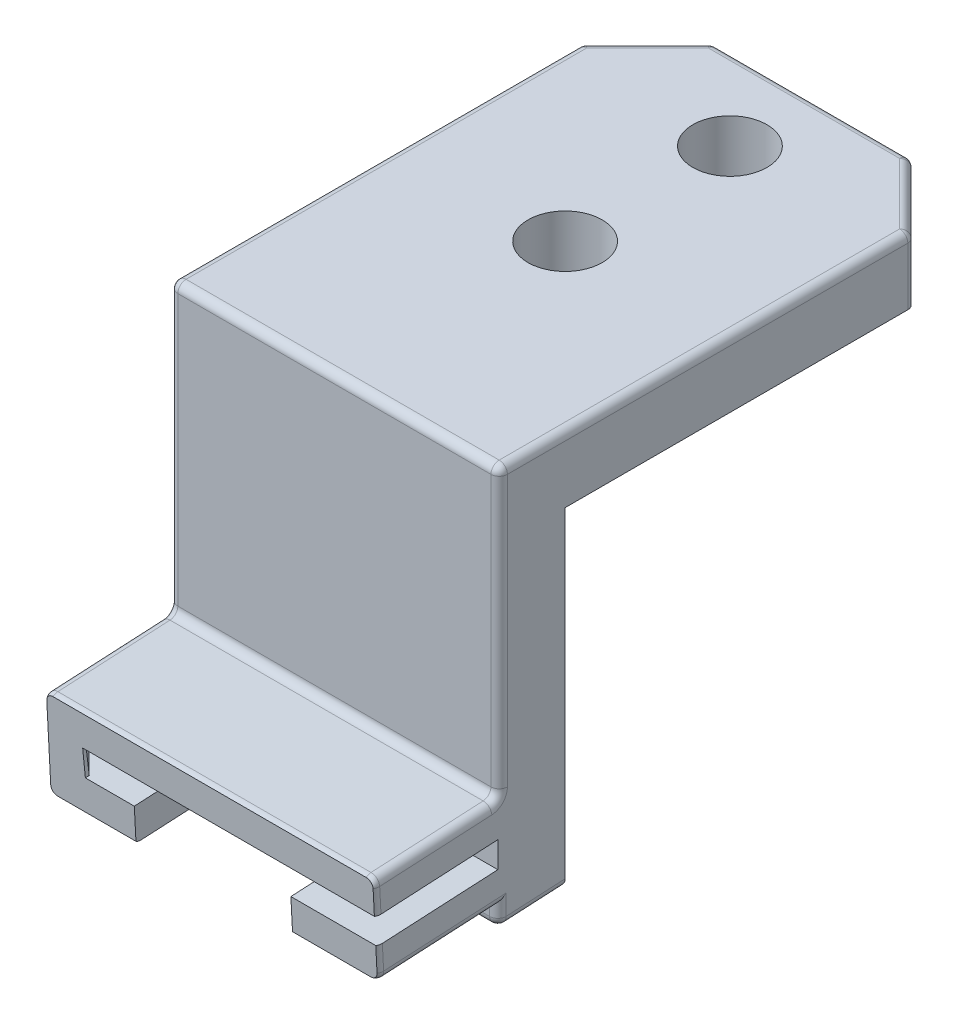
from build123d import *

# Parameters (mm, degrees)
SKETCH1_W                       = 25.4
SKETCH1_H                       = 31.75
SKETCH1_R                       = 2.8575
BOSS_EXTRUDE1_DEPTH             = 5.08
BOSS_EXTRUDE2_REACH             = 22.955
BOSS_EXTRUDE2_DIRECTION_2_REACH = 22.955
CUT_EXTRUDE3_REACH              = 56.752
BOSS_EXTRUDE3_DEPTH             = 2
BOSS_EXTRUDE3_DRAFT             = -3
CHAMFER1_SIZE                   = 5.08
FILLET1_R                       = 0.635
SKETCH8_W                       = 25.4
SKETCH8_H                       = 6.35
CUT_EXTRUDE4_DEPTH              = 41.010145227


with BuildPart() as part:
    # Sketch1 → Boss-Extrude1 (new body)
    with BuildSketch(Plane(origin=(0, 0, 0), x_dir=(1, 0, 0), z_dir=(0, 1, 0))):
        Rectangle(SKETCH1_W, SKETCH1_H)
        with Locations(Location((0, 9.525, 0), (0, 0, 270))):
            Circle(SKETCH1_R, mode=Mode.SUBTRACT)
        with Locations(Location((0, -3.175, 0), (0, 0, 270))):
            Circle(SKETCH1_R, mode=Mode.SUBTRACT)
    extrude(amount=BOSS_EXTRUDE1_DEPTH)

    # Boss-Extrude2: up to this face of the body (flat: up to its plane)
    boss_extrude2_end = Plane(part.part.faces().sort_by_distance((12.7, 2.54, 0))[0])
    # Sketch2 → Boss-Extrude2 (add, up to the picked face)
    with BuildSketch(Plane(origin=(0, 0, 0), x_dir=(0, 0, -1), z_dir=(1, 0, 0)), mode=Mode.PRIVATE) as boss_extrude2_sk1:
        Polygon((-15.875, 5.08), (-20.955, 5.08), (-20.955, -17.014374457), (-30.831377514, -17.53197347), (-30.460838941, -24.60227064), (-21.059671916, -24.109576354), (-21.059671916, -25.671717141), (-15.875, -25.4), align=None)
    boss_extrude2_tool1 = split(extrude(boss_extrude2_sk1.sketch, amount=BOSS_EXTRUDE2_REACH, mode=Mode.PRIVATE), bisect_by=boss_extrude2_end, keep=Keep.BOTH, mode=Mode.PRIVATE)
    # Sketch2 → Boss-Extrude2 (add, up to the picked face)
    with BuildSketch(Plane(origin=(0, 0, 0), x_dir=(0, 0, -1), z_dir=(1, 0, 0)), mode=Mode.PRIVATE) as boss_extrude2_sk2:
        Polygon((-30.698444185, -20.068492489), (-30.593772269, -22.065751622), (-21.059671916, -21.566090595), (-21.059671916, -19.563345839), align=None)
    boss_extrude2_tool2 = split(extrude(boss_extrude2_sk2.sketch, amount=BOSS_EXTRUDE2_REACH, mode=Mode.PRIVATE), bisect_by=boss_extrude2_end, keep=Keep.BOTH, mode=Mode.PRIVATE)
    add(boss_extrude2_tool1.solids().sort_by(Axis((0, -13.472044, 20.681092), (1, 0, 0)))[0])
    add(boss_extrude2_tool2.solids().sort_by(Axis((0, -20.8141, 25.852938), (1, 0, 0)))[0])

    # Boss-Extrude2 direction 2: up to this face of the body (flat: up to its plane)
    boss_extrude2_direction_2_end = Plane(part.part.faces().sort_by_distance((-12.7, 2.54, 0))[0])
    # Sketch2 → Boss-Extrude2 direction 2 (add, up to the picked face)
    with BuildSketch(Plane(origin=(0, 0, 0), x_dir=(0, 0, -1), z_dir=(1, 0, 0)), mode=Mode.PRIVATE) as boss_extrude2_direction_2_sk1:
        Polygon((-15.875, 5.08), (-20.955, 5.08), (-20.955, -17.014374457), (-30.831377514, -17.53197347), (-30.460838941, -24.60227064), (-21.059671916, -24.109576354), (-21.059671916, -25.671717141), (-15.875, -25.4), align=None)
    boss_extrude2_direction_2_tool1 = split(extrude(boss_extrude2_direction_2_sk1.sketch, amount=-BOSS_EXTRUDE2_DIRECTION_2_REACH, mode=Mode.PRIVATE), bisect_by=boss_extrude2_direction_2_end, keep=Keep.BOTH, mode=Mode.PRIVATE)
    # Sketch2 → Boss-Extrude2 direction 2 (add, up to the picked face)
    with BuildSketch(Plane(origin=(0, 0, 0), x_dir=(0, 0, -1), z_dir=(1, 0, 0)), mode=Mode.PRIVATE) as boss_extrude2_direction_2_sk2:
        Polygon((-30.698444185, -20.068492489), (-30.593772269, -22.065751622), (-21.059671916, -21.566090595), (-21.059671916, -19.563345839), align=None)
    boss_extrude2_direction_2_tool2 = split(extrude(boss_extrude2_direction_2_sk2.sketch, amount=-BOSS_EXTRUDE2_DIRECTION_2_REACH, mode=Mode.PRIVATE), bisect_by=boss_extrude2_direction_2_end, keep=Keep.BOTH, mode=Mode.PRIVATE)
    add(boss_extrude2_direction_2_tool1.solids().sort_by(Axis((0, -13.472044, 20.681092), (-1, 0, 0)))[0])
    add(boss_extrude2_direction_2_tool2.solids().sort_by(Axis((0, -20.8141, 25.852938), (-1, 0, 0)))[0])

    # Cut-Extrude3: up to this plane
    cut_extrude3_end = Plane(origin=(46.895925715, 0, 21.059671916), z_dir=(0, 0, -1))
    # Sketch4 → Cut-Extrude3 (cut, up to the surface)
    with BuildSketch(Plane(origin=(0, -1.659399249, 31.663223881), x_dir=(1, 0, 0), z_dir=(0, -0.052335956242941094, 0.9986295347545742)), mode=Mode.PRIVATE) as cut_extrude3_sk1:
        Polygon((-11.43, -20.434356949), (-6.0325, -20.434356949), (-6.0325, -22.974356949), (6.0325, -22.974356949), (6.0325, -20.434356949), (12.7, -20.434356949), (12.7, -18.434356885), (-11.43, -18.434356885), align=None)
    cut_extrude3_tool1 = split(extrude(cut_extrude3_sk1.sketch, amount=-CUT_EXTRUDE3_REACH, mode=Mode.PRIVATE), bisect_by=cut_extrude3_end, keep=Keep.BOTH, mode=Mode.PRIVATE)
    add(cut_extrude3_tool1.solids().sort_by_distance((0.388379, -21.947535, 30.599968))[0], mode=Mode.SUBTRACT)


with BuildPart() as boss_extrude3_tool:
    # Sketch5 → Boss-Extrude3 (with draft: the straight prism first)
    with BuildSketch(Plane(origin=(0, -18.40909324, -0.964779695), x_dir=(1, 0, 0), z_dir=(0, -0.9986295347545742, -0.052335956242941115))):
        Polygon((-11.43, 29.674676779), (-9.906, 31.198676779), (-9.906, 31.706676779), (-11.43, 31.706676779), align=None)
    extrude(amount=BOSS_EXTRUDE3_DEPTH)
    # Boss-Extrude3: the draft: its side faces are tilted about the plane it starts from
    boss_extrude3_sides = [boss_extrude3_tool.faces().sort_by_distance(p)[0] for p in [
        (-10.668, -21.000655359, 29.37784872),
        (-9.906, -21.05382869, 30.392456327),
        (-10.668, -21.067122023, 30.646108229),
        (-11.43, -21.013948692, 29.631500622),
    ]]
    draft(boss_extrude3_sides, Plane(origin=(0, -18.40909324, -0.964779695), x_dir=(1, 0, 0), z_dir=(0, -0.9986295347545742, -0.052335956242941115)), BOSS_EXTRUDE3_DRAFT)


with BuildPart() as part_1:
    add(part.part)

    # Boss-Extrude3: add boss_extrude3_tool
    add(boss_extrude3_tool.part)

    # Chamfer1
    chamfer1_edges = [part_1.edges().sort_by_distance(p)[0] for p in [
        (-12.7, 2.54, -15.875),
        (12.7, 2.54, -15.875),
    ]]
    chamfer(chamfer1_edges, length=CHAMFER1_SIZE)

    # Fillet1
    fillet1_edges = [part_1.edges().sort_by_distance(p)[0] for p in [
        (12.7, -5.967187229, 20.955),
        (0, 5.08, 20.955),
        (12.7, -25.535858571, 18.467335958),
        (0, -25.671717141, 21.059671916),
        (12.7, -24.890646748, 21.059671916),
        (12.7, -24.355923497, 25.760255428),
        (9.36625, -24.60227064, 30.460838941),
        (12.7, -23.334011131, 30.527305605),
        (0, -17.53197347, 30.831377514),
        (12.7, -17.273173964, 25.893188757),
        (0, -17.014374457, 20.955),
        (-12.7, -17.273173964, 25.893188757),
        (-12.7, -5.967187229, 20.955),
        (-12.7, -25.535858571, 18.467335958),
        (-12.7, -24.890646748, 21.059671916),
        (-12.7, -24.355923497, 25.760255428),
        (-12.7, -21.067122055, 30.646108227),
        (-9.36625, -24.60227064, 30.460838941),
        (12.7, -18.800232979, 30.76491085),
        (12.7, 5.08, 5.08),
        (-12.7, 5.08, 5.08),
        (-12.7, 2.54, -10.795),
        (0, 5.08, -15.875),
        (7.62, 2.54, -15.875),
        (-7.62, 2.54, -15.875),
        (10.16, 5.08, -13.335),
        (-10.16, 5.08, -13.335),
        (12.7, 2.54, -10.795),
    ]]
    fillet(fillet1_edges, radius=FILLET1_R)

    # Sketch8 → Cut-Extrude4 (cut, through all)
    with BuildSketch(Plane(origin=(0, -15.872574222, -0.831846366), x_dir=(1, 0, 0), z_dir=(0, 0.9986295347545742, 0.05233595624294136))):
        with Locations((0, -34.627676779)):
            Rectangle(SKETCH8_W, SKETCH8_H)
    extrude(amount=-CUT_EXTRUDE4_DEPTH, mode=Mode.SUBTRACT)


solid = part_1.part
